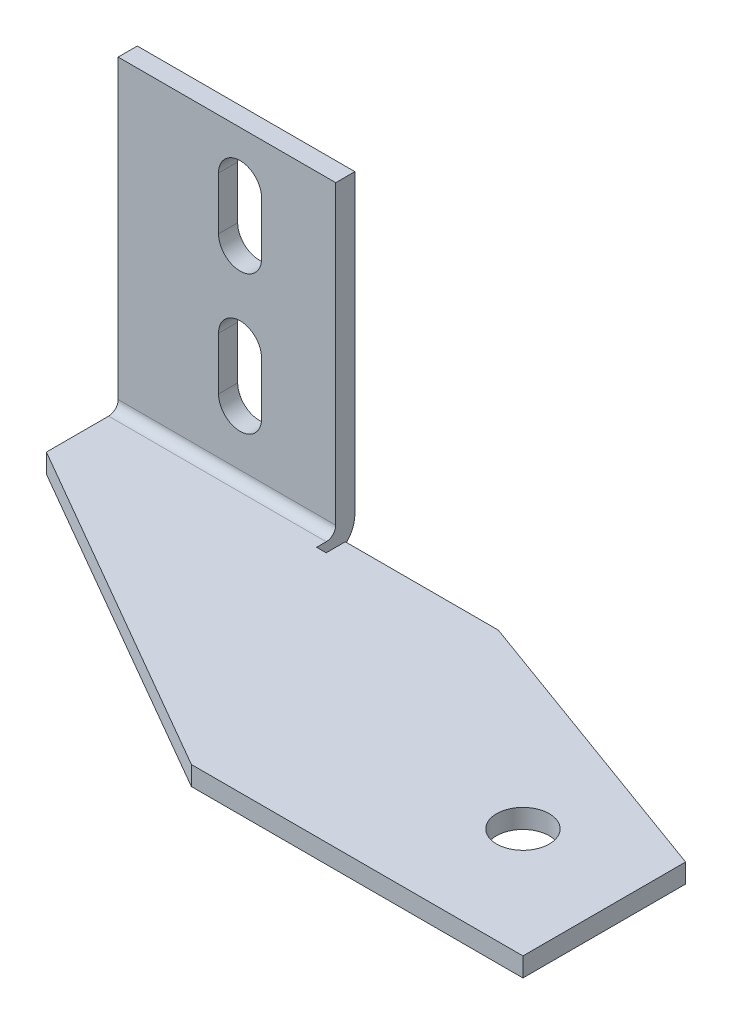
from build123d import *

# Parameters (mm, degrees)
EXTRUDE_1_DEPTH     = 2
SKETCH_2_R          = 2.75
CUT_EXTRUDE_1_DEPTH = 76.957158978
SKETCH_3_W          = 22.737902435
SKETCH_3_H          = 2
EXTRUDE_2_DEPTH     = 34
CUT_EXTRUDE_2_DEPTH = 84.195492666
SKETCH_7_W          = 1
SKETCH_7_H          = 2
CUT_EXTRUDE_3_DEPTH = 2
FILLET_1_R          = 3
FILLET_2_R          = 1


with BuildPart() as part:
    # 草图1 → 凸台-拉伸1 (new body)
    with BuildSketch(Plane(origin=(0, 0, 0), x_dir=(1, 0, 0), z_dir=(0, 1, 0))):
        Polygon((0, 0), (39.728252902, 0), (70.5, -11.2), (70.5, -28.2), (35.853451717, -28.2), (0, -7.5), align=None)
    extrude(amount=EXTRUDE_1_DEPTH)

    # 草图2 → 切除-拉伸1 (cut, through all)
    with BuildSketch(Plane(origin=(0, 2, 0), x_dir=(1, 0, 0), z_dir=(0, 1, 0))):
        with Locations(Location((59, -16.7, 0), (0, 0, 270))):
            Circle(SKETCH_2_R)
    extrude(amount=-CUT_EXTRUDE_1_DEPTH, mode=Mode.SUBTRACT)

    # 草图3 → 凸台-拉伸2 (add)
    with BuildSketch(Plane.XZ):
        with Locations((11.368951218, -1)):
            Rectangle(SKETCH_3_W, SKETCH_3_H)
    extrude(amount=-EXTRUDE_2_DEPTH)

    # 草图4 → 切除-拉伸2 (cut, through all)
    with BuildSketch(Plane(origin=(0, 0, 0), x_dir=(-1, 0, 0), z_dir=(0, 0, -1))):
        with BuildLine():
            Line((-14.987902435, 28.75), (-14.987902435, 23.25))
            ThreePointArc((-14.987902435, 23.25), (-12.737902435, 21), (-10.487902435, 23.25))
            Line((-10.487902435, 23.25), (-10.487902435, 28.75))
            ThreePointArc((-10.487902435, 28.75), (-12.737902435, 31), (-14.987902435, 28.75))
        make_face()
        with BuildLine():
            Line((-14.987902435, 14.25), (-14.987902435, 8.75))
            ThreePointArc((-14.987902435, 8.75), (-12.737902435, 6.5), (-10.487902435, 8.75))
            Line((-10.487902435, 8.75), (-10.487902435, 14.25))
            ThreePointArc((-10.487902435, 14.25), (-12.737902435, 16.5), (-14.987902435, 14.25))
        make_face()
    extrude(amount=CUT_EXTRUDE_2_DEPTH, mode=Mode.SUBTRACT)

    # 草图7 → 切除-拉伸3 (cut)
    with BuildSketch(Plane(origin=(0, 2, 0), x_dir=(1, 0, 0), z_dir=(0, 1, 0))):
        with Locations((23.237902435, -1)):
            Rectangle(SKETCH_7_W, SKETCH_7_H)
    extrude(amount=-CUT_EXTRUDE_3_DEPTH, mode=Mode.SUBTRACT)

    # 圆角1
    fillet_1_edges = [part.edges().sort_by_distance(p)[0] for p in [
        (11.368951218, 0, -2),
    ]]
    fillet(fillet_1_edges, radius=FILLET_1_R)

    # 圆角2
    fillet_2_edges = [part.edges().sort_by_distance(p)[0] for p in [
        (11.368951218, 2, 0),
    ]]
    fillet(fillet_2_edges, radius=FILLET_2_R)


solid = part.part
